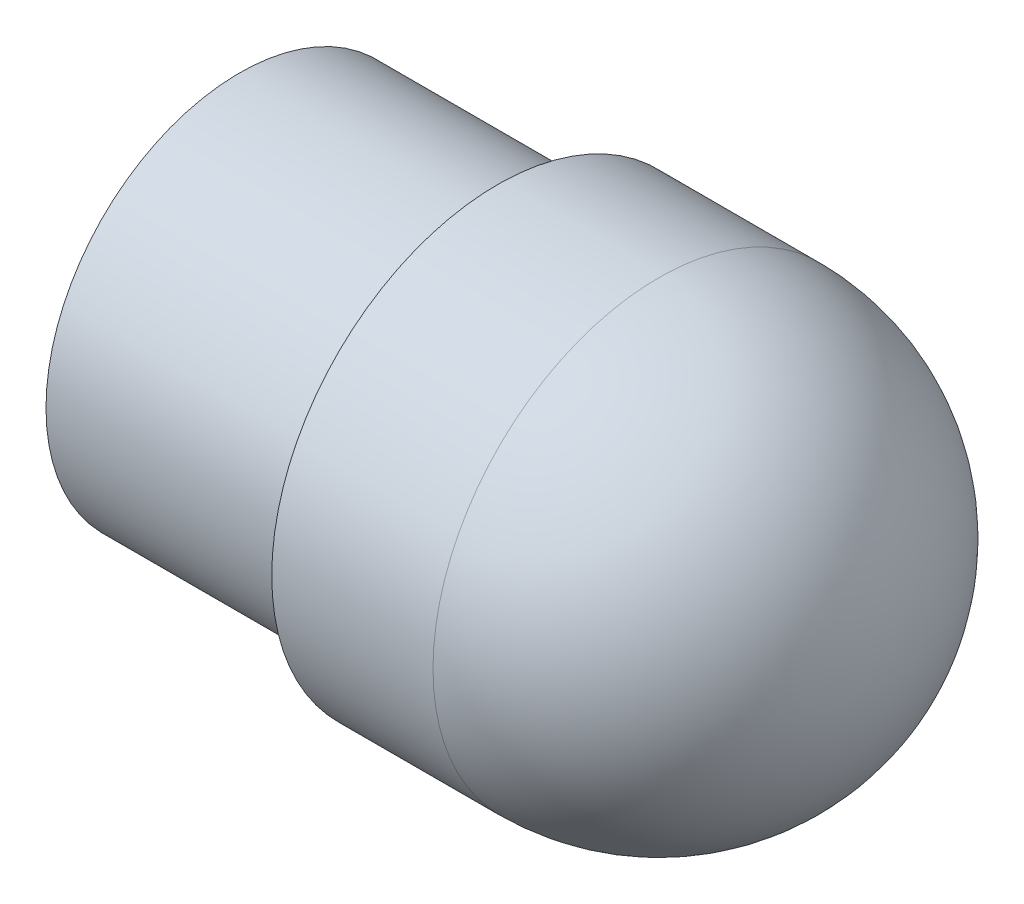
from build123d import *

# Parameters (mm, degrees)
ESQUISSE1_W = 200
ESQUISSE1_H = 150


with BuildPart() as part:
    # Esquisse1 → Révolution1 (revolve)
    with BuildSketch(Plane.XY, mode=Mode.PRIVATE) as r_volution1_sk:
        with Locations((72.852391376, -75)):
            Rectangle(ESQUISSE1_W, ESQUISSE1_H)
        Polygon((297.852391376, -175), (297.852391376, 0), (172.852391376, 0), (172.852391376, -150), (172.852391376, -175), align=None)
        with BuildLine():
            Line((297.852391376, -175), (297.852391376, 0))
            Line((297.852391376, 0), (472.852391376, 0))
            ThreePointArc((472.852391376, 0), (421.596078083, -123.743686708), (297.852391376, -175))
        make_face()
    revolve(r_volution1_sk.sketch.rotate(Axis((-59.505958349, 0, 0), (1, 0, 0)), 270), axis=Axis((-59.505958349, 0, 0), (1, 0, 0)))


solid = part.part
